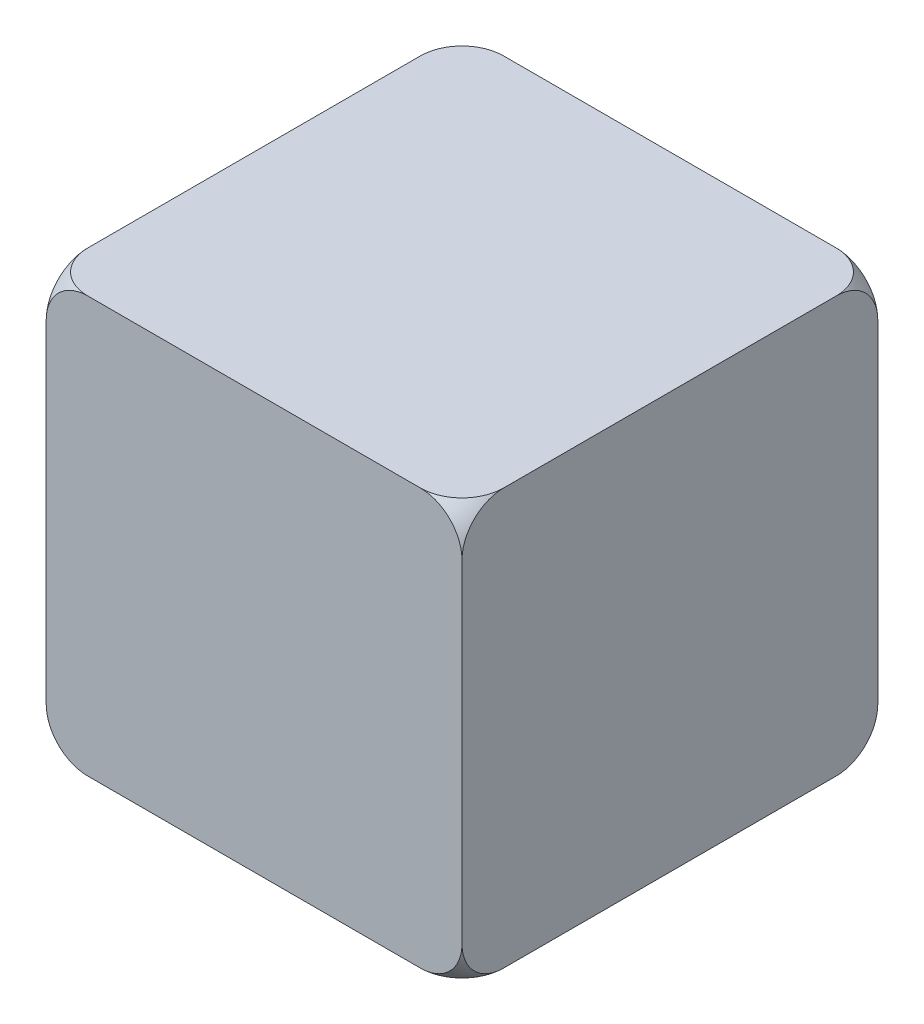
from build123d import *

# Parameters (mm, degrees)
PADR_O_LINEAR2_COUNT       = 2
PADR_O_LINEAR2_PITCH       = 8
PADR_O_LINEAR2_2_COUNT     = 2
PADR_O_LINEAR2_2_PITCH     = 8
CORTE_EXTRUS_O1_DEPTH      = 19.037947011
CORTE_EXTRUS_O1_DEPTH_BACK = 19.037947011
ESBO_O3_W                  = 20
ESBO_O3_H                  = 20
ESBO_O3_W_2                = 1
ESBO_O3_H_2                = 1
CORTE_EXTRUS_O3_DEPTH      = 20
CORTE_EXTRUS_O3_DEPTH_BACK = 10
ESBO_O4_W                  = 20
ESBO_O4_H                  = 20
ESBO_O4_W_2                = 1
ESBO_O4_H_2                = 1
ESBO_O5_W                  = 10
ESBO_O5_H                  = 10
RESSALTO_EXTRUS_O1_DEPTH   = 8
ESBO_O6_W                  = 10
ESBO_O6_H                  = 10
RESSALTO_EXTRUS_O2_DEPTH   = 8
ESBO_O7_W                  = 10
ESBO_O7_H                  = 10
RESSALTO_EXTRUS_O3_DEPTH   = 8


with BuildPart() as part:
    # Esboço2 → Revolução1 (revolve)
    with BuildSketch(Plane.XY.offset(1)):
        with BuildLine():
            Line((1, 1), (-0.414213562, 1))
            ThreePointArc((-0.414213562, 1), (1, -0.414213562), (2.414213562, 1))
            Line((2.414213562, 1), (1, 1))
        make_face()
        with BuildLine():
            Line((9, 1), (7.585786438, 1))
            ThreePointArc((7.585786438, 1), (9, -0.414213562), (10.414213562, 1))
            Line((10.414213562, 1), (9, 1))
        make_face()
    revolve(axis=Axis((1, 1, 1), (-1, 0, 0)))


with BuildPart() as padr_o_linear2_1:
    # Padrão linear2: pattern copy
    add(part.part.moved(Location(Vector(0, 0, 1) * (1 * PADR_O_LINEAR2_PITCH))))


with BuildPart() as padr_o_linear2_2_1:
    # Padr_o linear2 2: pattern copy
    add(part.part.moved(Location(Vector(0, 1, 0) * (1 * PADR_O_LINEAR2_2_PITCH))))


with BuildPart() as padr_o_linear2_2_2:
    # Padr_o linear2 2: pattern copy
    add(padr_o_linear2_1.part.moved(Location(Vector(0, 1, 0) * (1 * PADR_O_LINEAR2_2_PITCH))))


with BuildPart() as corte_extrus_o1_tool:
    # Esboço3 → Corte-extrusão1 (new, two sides: drawn at the far end of the back side and taken through both)
    with BuildSketch(Plane.XY.offset(-CORTE_EXTRUS_O1_DEPTH_BACK)):
        with Locations((5, 5)):
            Rectangle(ESBO_O3_W, ESBO_O3_H)
        with Locations((0.5, 9.5)):
            Rectangle(ESBO_O3_W_2, ESBO_O3_H_2, mode=Mode.SUBTRACT)
        with Locations((0.5, 0.5)):
            Rectangle(ESBO_O3_W_2, ESBO_O3_H_2, mode=Mode.SUBTRACT)
        with Locations((9.5, 0.5)):
            Rectangle(ESBO_O3_W_2, ESBO_O3_H_2, mode=Mode.SUBTRACT)
        with Locations((9.5, 9.5)):
            Rectangle(ESBO_O3_W_2, ESBO_O3_H_2, mode=Mode.SUBTRACT)
    extrude(amount=CORTE_EXTRUS_O1_DEPTH + CORTE_EXTRUS_O1_DEPTH_BACK)


with BuildPart() as part_1:
    add(part.part)

    # Corte-extrusão1: cut by corte_extrus_o1_tool
    add(corte_extrus_o1_tool.part, mode=Mode.SUBTRACT)


with BuildPart() as padr_o_linear2_1_1:
    add(padr_o_linear2_1.part)

    # Corte-extrusão1: cut by corte_extrus_o1_tool
    add(corte_extrus_o1_tool.part, mode=Mode.SUBTRACT)


with BuildPart() as padr_o_linear2_2_1_1:
    add(padr_o_linear2_2_1.part)

    # Corte-extrusão1: cut by corte_extrus_o1_tool
    add(corte_extrus_o1_tool.part, mode=Mode.SUBTRACT)


with BuildPart() as padr_o_linear2_2_2_1:
    add(padr_o_linear2_2_2.part)

    # Corte-extrusão1: cut by corte_extrus_o1_tool
    add(corte_extrus_o1_tool.part, mode=Mode.SUBTRACT)


with BuildPart() as corte_extrus_o3_tool:
    # Esboço4 → Corte-extrusão3 (new, two sides: drawn at the far end of the back side and taken through both)
    with BuildSketch(Plane(origin=(0, 0, 0), x_dir=(0, 0, -1), z_dir=(1, 0, 0)).offset(-CORTE_EXTRUS_O3_DEPTH_BACK)):
        with Locations((-5, 5)):
            Rectangle(ESBO_O4_W, ESBO_O4_H)
        with Locations((-9.5, 9.5)):
            Rectangle(ESBO_O4_W_2, ESBO_O4_H_2, mode=Mode.SUBTRACT)
        with Locations((-0.5, 0.5)):
            Rectangle(ESBO_O4_W_2, ESBO_O4_H_2, mode=Mode.SUBTRACT)
        with Locations((-0.5, 9.5)):
            Rectangle(ESBO_O4_W_2, ESBO_O4_H_2, mode=Mode.SUBTRACT)
        with Locations((-9.5, 0.5)):
            Rectangle(ESBO_O4_W_2, ESBO_O4_H_2, mode=Mode.SUBTRACT)
    extrude(amount=CORTE_EXTRUS_O3_DEPTH + CORTE_EXTRUS_O3_DEPTH_BACK)


with BuildPart() as part_2:
    add(part_1.part)

    # Corte-extrusão3: cut by corte_extrus_o3_tool
    add(corte_extrus_o3_tool.part, mode=Mode.SUBTRACT)



with BuildPart() as padr_o_linear2_1_2:
    add(padr_o_linear2_1_1.part)

    # Corte-extrusão3: cut by corte_extrus_o3_tool
    add(corte_extrus_o3_tool.part, mode=Mode.SUBTRACT)


with BuildPart() as padr_o_linear2_2_1_2:
    add(padr_o_linear2_2_1_1.part)

    # Corte-extrusão3: cut by corte_extrus_o3_tool
    add(corte_extrus_o3_tool.part, mode=Mode.SUBTRACT)


with BuildPart() as padr_o_linear2_2_2_2:
    add(padr_o_linear2_2_2_1.part)

    # Corte-extrusão3: cut by corte_extrus_o3_tool
    add(corte_extrus_o3_tool.part, mode=Mode.SUBTRACT)


with BuildPart() as part_3:
    add(part_2.part)

    add(padr_o_linear2_1_2.part)  # Ressalto-extrusão1 merges Padrão linear2_1

    add(padr_o_linear2_2_1_2.part)  # Ressalto-extrusão1 merges Padrão linear2 2_1

    add(padr_o_linear2_2_2_2.part)  # Ressalto-extrusão1 merges Padrão linear2 2_2
    # Esboço5 → Ressalto-extrusão1 (add)
    with BuildSketch(Plane.XY.offset(1)):
        with Locations((5, 5)):
            Rectangle(ESBO_O5_W, ESBO_O5_H)
    extrude(amount=RESSALTO_EXTRUS_O1_DEPTH)

    # Esboço6 → Ressalto-extrusão2 (add)
    with BuildSketch(Plane(origin=(1, 0, 0), x_dir=(0, 0, -1), z_dir=(1, 0, 0))):
        with Locations((-5, 5)):
            Rectangle(ESBO_O6_W, ESBO_O6_H)
    extrude(amount=RESSALTO_EXTRUS_O2_DEPTH)

    # Esboço7 → Ressalto-extrusão3 (add)
    with BuildSketch(Plane(origin=(0, 1, 0), x_dir=(1, 0, 0), z_dir=(0, 1, 0))):
        with Locations((5, -5)):
            Rectangle(ESBO_O7_W, ESBO_O7_H)
    extrude(amount=RESSALTO_EXTRUS_O3_DEPTH)


solid = part_3.part
